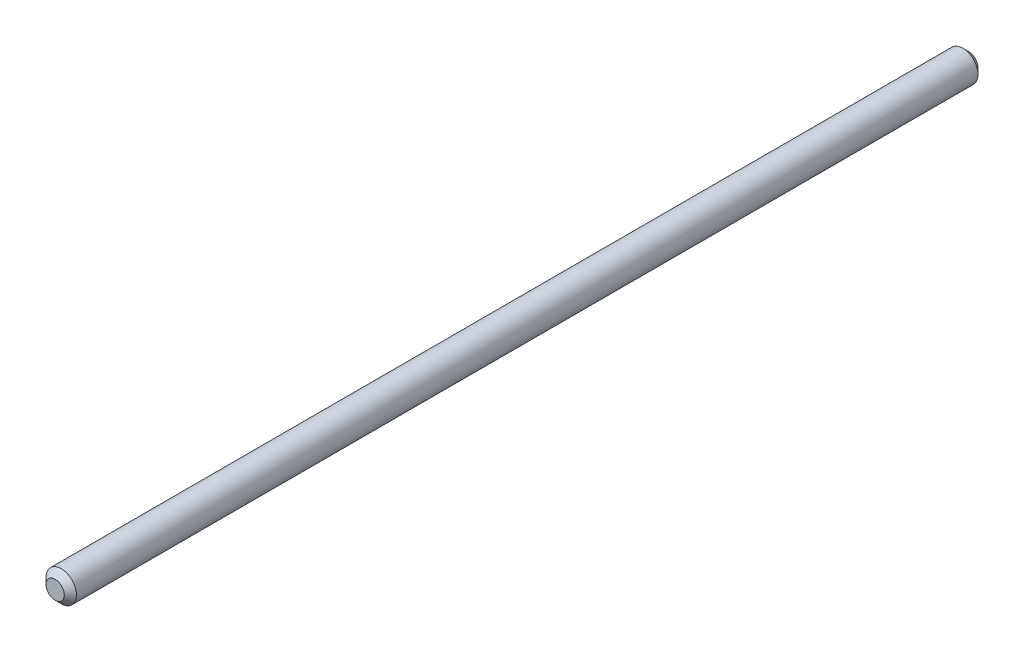
from build123d import *

# Parameters (mm, degrees)
SKETCH1_R           = 2.5
BOSS_EXTRUDE1_DEPTH = 150
CHAMFER1_SIZE       = 1


with BuildPart() as part:
    # Sketch1 → Boss-Extrude1 (new body)
    with BuildSketch(Plane.XY):
        Circle(SKETCH1_R)
    extrude(amount=BOSS_EXTRUDE1_DEPTH)

    # Chamfer1
    chamfer1_edges = [part.edges().sort_by_distance(p)[0] for p in [
        (-2.5, 0, 0),
        (-2.5, 0, 150),
    ]]
    chamfer(chamfer1_edges, length=CHAMFER1_SIZE)


solid = part.part
